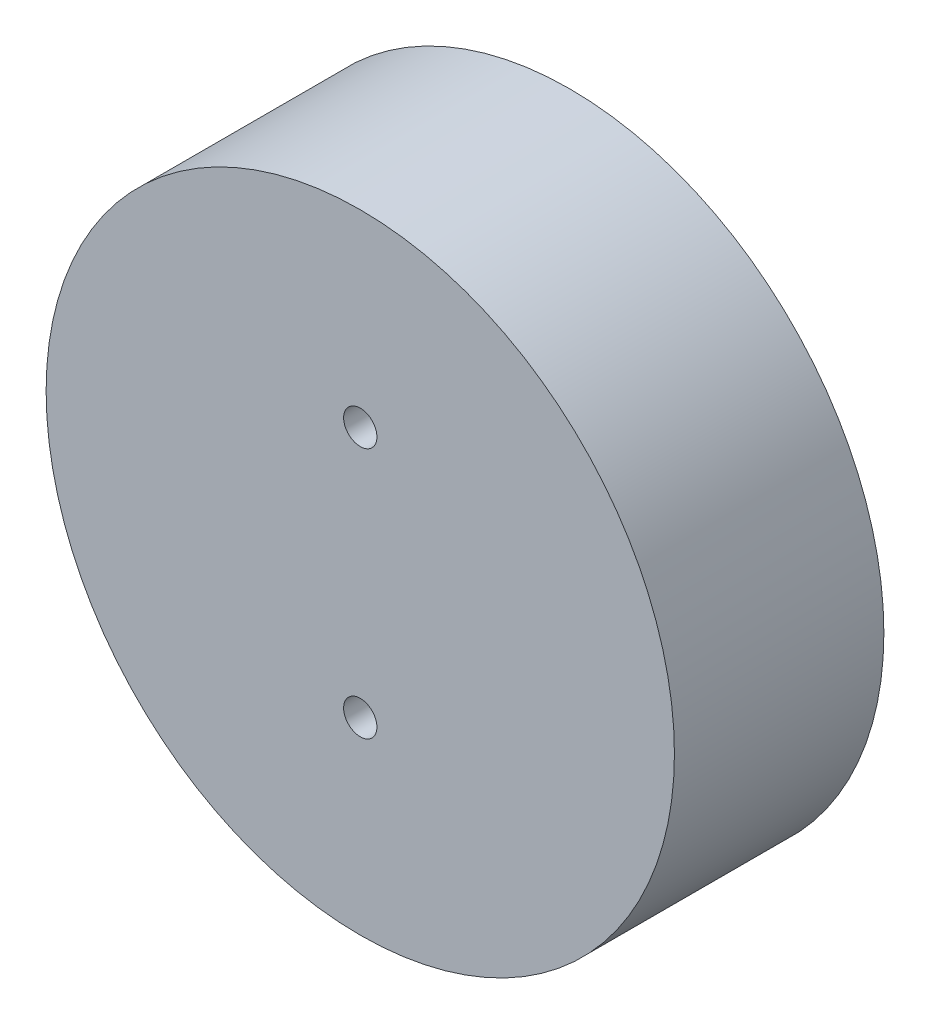
from build123d import *

# Parameters (mm, degrees)
F_10_32_TAPPED_HOLE1_D = 4.0386


with BuildPart() as part:
    # Sketch1 → Revolve2 (revolve)
    with BuildSketch(Plane(origin=(0, 0, 0), x_dir=(0, 0, -1), z_dir=(1, 0, 0)), mode=Mode.PRIVATE) as revolve2_sk:
        Polygon((0, 38.1), (25.4, 38.1), (25.4, 30.48), (28.194, 30.48), (28.194, 0), (0, 0), align=None)
    revolve(revolve2_sk.sketch.rotate(Axis((0, 0, 0), (0, 0, -1)), 180), axis=Axis((0, 0, 0), (0, 0, -1)))

    # #10-32 Tapped Hole1 (through all)
    with Locations(Plane(origin=(0, 0, -28.194), x_dir=(-1, 0, 0), z_dir=(0, 0, -1))):
        with Locations((0, 15.24), (0, -15.24)):
            Hole(F_10_32_TAPPED_HOLE1_D / 2)


solid = part.part
